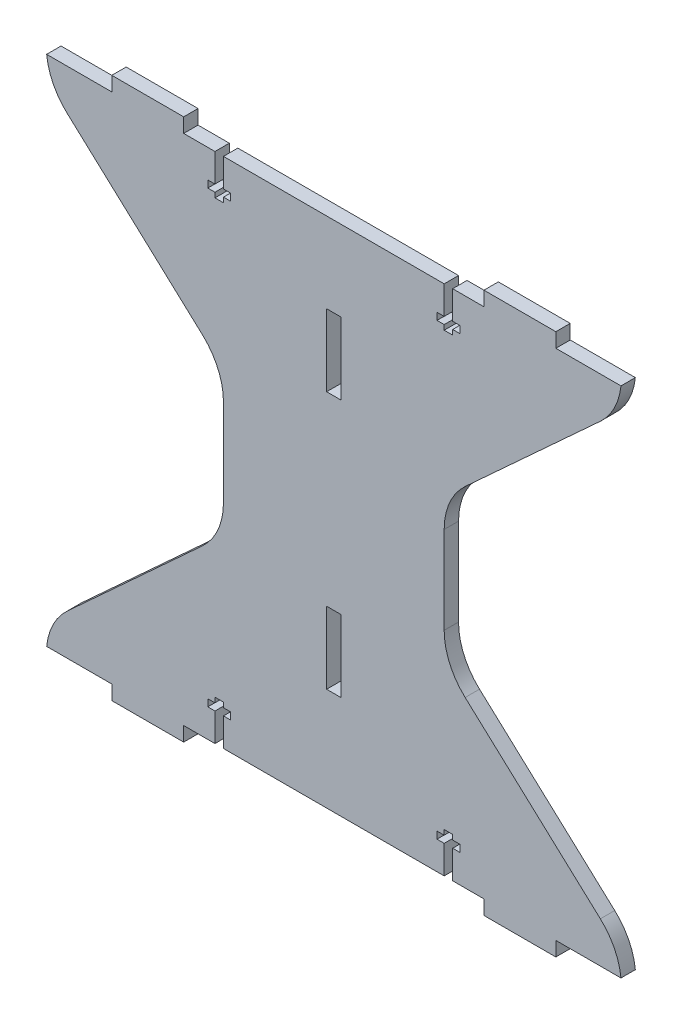
from build123d import *

# Parameters (mm, degrees)
SKETCH1_W           = 5.08
SKETCH1_H           = 25.4
BOSS_EXTRUDE1_DEPTH = 5.08


with BuildPart() as part:
    # Sketch1 → Boss-Extrude1 (new body)
    with BuildSketch(Plane.XY):
        with BuildLine():
            Line((-14.800406259, 88.667051475), (-13.447242614, 88.667051475))
            Line((-13.447242614, 88.667051475), (-13.447242614, 93.747051475))
            Line((-13.447242614, 93.747051475), (9.557461427, 93.747051475))
            ThreePointArc((9.557461427, 93.747051475), (7.2409193, 101.644458486), (2.277698276, 108.209657797))
            Line((2.277698276, 108.209657797), (-45.487793081, 152.041039764))
            ThreePointArc((-45.487793081, 152.041039764), (-50.959133788, 159.684872704), (-52.891849255, 168.884240186))
            Line((-52.891849255, 168.884240186), (-52.891849255, 188.293861482))
            Line((-52.891849255, 188.293861482), (-52.891849255, 199.743466198))
            ThreePointArc((-52.891849255, 199.743466198), (-50.959133788, 208.94283368), (-45.487793081, 216.58666662))
            Line((-45.487793081, 216.58666662), (2.277698276, 260.418048586))
            ThreePointArc((2.277698276, 260.418048586), (7.2409193, 266.983247897), (9.557461427, 274.880654909))
            Line((9.557461427, 274.880654909), (-13.447242614, 274.880654909))
            Line((-13.447242614, 274.880654909), (-13.447242614, 279.960654909))
            Line((-13.447242614, 279.960654909), (-14.800406259, 279.960654909))
            Line((-14.800406259, 279.960654909), (-38.847242614, 279.960654909))
            Line((-38.847242614, 279.960654909), (-38.847242614, 274.880654909))
            Line((-38.847242614, 274.880654909), (-49.891849255, 274.880654909))
            Line((-49.891849255, 274.880654909), (-49.891849255, 264.914705614))
            Line((-49.891849255, 264.914705614), (-47.351849255, 264.914705614))
            Line((-47.351849255, 264.914705614), (-47.351849255, 262.414705614))
            Line((-47.351849255, 262.414705614), (-49.891849255, 262.414705614))
            Line((-49.891849255, 262.414705614), (-49.891849255, 260.680654909))
            Line((-49.891849255, 260.680654909), (-52.891849255, 260.680654909))
            Line((-52.891849255, 260.680654909), (-52.891849255, 262.414705614))
            Line((-52.891849255, 262.414705614), (-55.431849255, 262.414705614))
            Line((-55.431849255, 262.414705614), (-55.431849255, 264.914705614))
            Line((-55.431849255, 264.914705614), (-52.891849255, 264.914705614))
            Line((-52.891849255, 264.914705614), (-52.891849255, 274.880654909))
            Line((-52.891849255, 274.880654909), (-130.862222045, 274.880654909))
            Line((-130.862222045, 274.880654909), (-130.862222045, 264.914705614))
            Line((-130.862222045, 264.914705614), (-128.322222045, 264.914705614))
            Line((-128.322222045, 264.914705614), (-128.322222045, 262.414705614))
            Line((-128.322222045, 262.414705614), (-130.862222045, 262.414705614))
            Line((-130.862222045, 262.414705614), (-130.862222045, 260.680654909))
            Line((-130.862222045, 260.680654909), (-133.862222045, 260.680654909))
            Line((-133.862222045, 260.680654909), (-133.862222045, 262.414705614))
            Line((-133.862222045, 262.414705614), (-136.402222045, 262.414705614))
            Line((-136.402222045, 262.414705614), (-136.402222045, 264.914705614))
            Line((-136.402222045, 264.914705614), (-133.862222045, 264.914705614))
            Line((-133.862222045, 264.914705614), (-133.862222045, 274.880654909))
            Line((-133.862222045, 274.880654909), (-144.906828687, 274.880654909))
            Line((-144.906828687, 274.880654909), (-144.906828687, 279.960654909))
            Line((-144.906828687, 279.960654909), (-168.953665042, 279.960654909))
            Line((-168.953665042, 279.960654909), (-170.306828687, 279.960654909))
            Line((-170.306828687, 279.960654909), (-170.306828687, 274.880654909))
            Line((-170.306828687, 274.880654909), (-193.311532727, 274.880654909))
            ThreePointArc((-193.311532727, 274.880654909), (-190.9949906, 266.983247897), (-186.031769576, 260.418048586))
            Line((-186.031769576, 260.418048586), (-138.266278219, 216.58666662))
            ThreePointArc((-138.266278219, 216.58666662), (-132.794937512, 208.94283368), (-130.862222045, 199.743466198))
            Line((-130.862222045, 199.743466198), (-130.862222045, 188.293861482))
            Line((-130.862222045, 188.293861482), (-130.862222045, 168.884240186))
            ThreePointArc((-130.862222045, 168.884240186), (-132.794937512, 159.684872704), (-138.266278219, 152.041039764))
            Line((-138.266278219, 152.041039764), (-186.031769576, 108.209657797))
            ThreePointArc((-186.031769576, 108.209657797), (-190.9949906, 101.644458486), (-193.311532727, 93.747051475))
            Line((-193.311532727, 93.747051475), (-170.306828687, 93.747051475))
            Line((-170.306828687, 93.747051475), (-170.306828687, 88.667051475))
            Line((-170.306828687, 88.667051475), (-168.953665042, 88.667051475))
            Line((-168.953665042, 88.667051475), (-144.906828687, 88.667051475))
            Line((-144.906828687, 88.667051475), (-144.906828687, 93.747051475))
            Line((-144.906828687, 93.747051475), (-133.862222045, 93.747051475))
            Line((-133.862222045, 93.747051475), (-133.862222045, 103.713000769))
            Line((-133.862222045, 103.713000769), (-136.402222045, 103.713000769))
            Line((-136.402222045, 103.713000769), (-136.402222045, 106.213000769))
            Line((-136.402222045, 106.213000769), (-133.862222045, 106.213000769))
            Line((-133.862222045, 106.213000769), (-133.862222045, 107.947051475))
            Line((-133.862222045, 107.947051475), (-130.862222045, 107.947051475))
            Line((-130.862222045, 107.947051475), (-130.862222045, 106.213000769))
            Line((-130.862222045, 106.213000769), (-128.322222045, 106.213000769))
            Line((-128.322222045, 106.213000769), (-128.322222045, 103.713000769))
            Line((-128.322222045, 103.713000769), (-130.862222045, 103.713000769))
            Line((-130.862222045, 103.713000769), (-130.862222045, 93.747051475))
            Line((-130.862222045, 93.747051475), (-52.891849255, 93.747051475))
            Line((-52.891849255, 93.747051475), (-52.891849255, 103.713000769))
            Line((-52.891849255, 103.713000769), (-55.431849255, 103.713000769))
            Line((-55.431849255, 103.713000769), (-55.431849255, 106.213000769))
            Line((-55.431849255, 106.213000769), (-52.891849255, 106.213000769))
            Line((-52.891849255, 106.213000769), (-52.891849255, 107.947051475))
            Line((-52.891849255, 107.947051475), (-49.891849255, 107.947051475))
            Line((-49.891849255, 107.947051475), (-49.891849255, 106.213000769))
            Line((-49.891849255, 106.213000769), (-47.351849255, 106.213000769))
            Line((-47.351849255, 106.213000769), (-47.351849255, 103.713000769))
            Line((-47.351849255, 103.713000769), (-49.891849255, 103.713000769))
            Line((-49.891849255, 103.713000769), (-49.891849255, 93.747051475))
            Line((-49.891849255, 93.747051475), (-38.847242614, 93.747051475))
            Line((-38.847242614, 93.747051475), (-38.847242614, 88.667051475))
            Line((-38.847242614, 88.667051475), (-14.800406259, 88.667051475))
        make_face()
        with Locations((-91.87703565, 142.791515907)):
            Rectangle(SKETCH1_W, SKETCH1_H, mode=Mode.SUBTRACT)
        with Locations((-91.87703565, 233.796207057)):
            Rectangle(SKETCH1_W, SKETCH1_H, mode=Mode.SUBTRACT)
    extrude(amount=BOSS_EXTRUDE1_DEPTH)


solid = part.part
